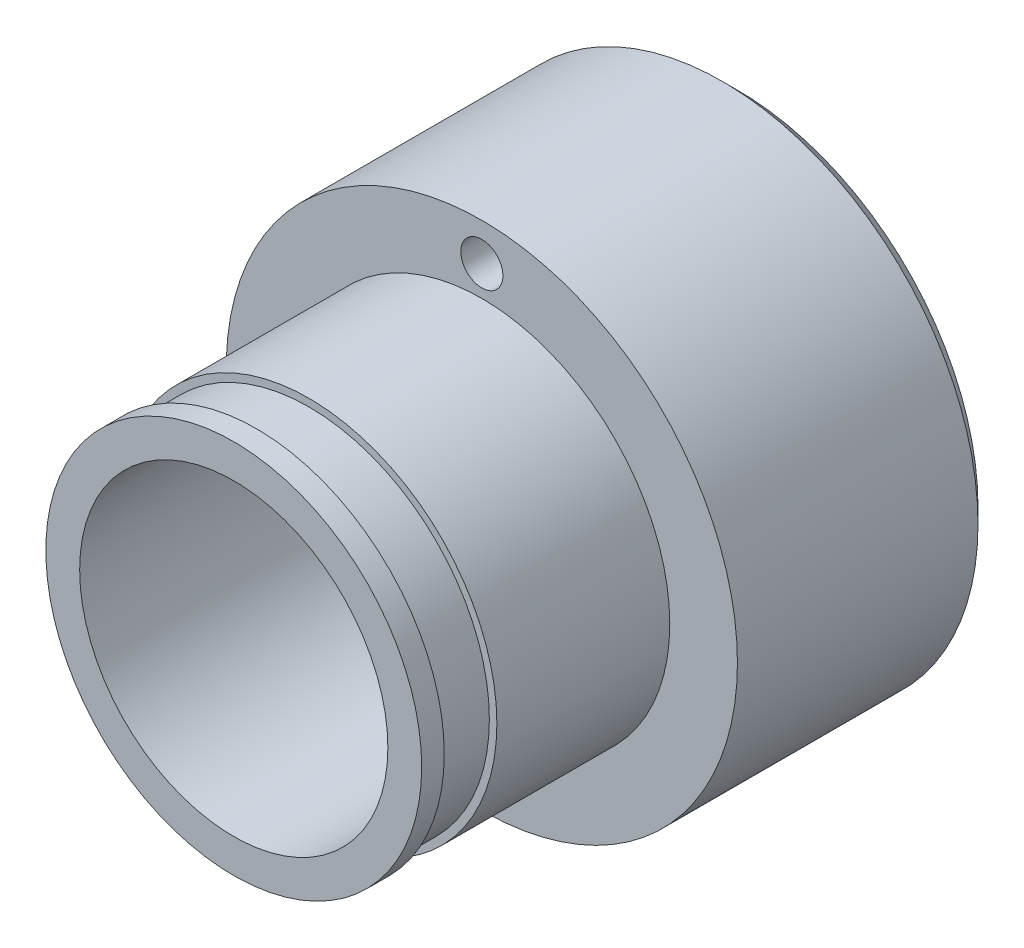
from build123d import *

# Parameters (mm, degrees)
ESQUISSE1_R                    = 17
BOSS_EXTRU_1_DEPTH             = 17
ESQUISSE2_R                    = 12.5
BOSS_EXTRU_2_DEPTH             = 11.5
ESQUISSE3_R                    = 12
BOSS_EXTRU_3_DEPTH             = 3.5
ESQUISSE4_R                    = 12.5
BOSS_EXTRU_4_DEPTH             = 1.5
ESQUISSE5_R                    = 10.25
ENL_V_MAT_EXTRU_1_DEPTH        = 30
ESQUISSE6_R                    = 10.25
ESQUISSE6_R_2                  = 6.75
ENL_V_MAT_EXTRU_2_DEPTH        = 1.5
ESQUISSE7_R                    = 12
ESQUISSE7_R_2                  = 10.25
ENL_V_MAT_EXTRU_3_DEPTH        = 2
F_2_8_2_8_DIAMETER_HOLE1_D     = 2.8
F_2_8_2_8_DIAMETER_HOLE1_DEPTH = 12
F_2_8_2_8_DIAMETER_HOLE1_TIP   = 0.841204867
CHANFREIN1_SIZE                = 1


with BuildPart() as part:
    # Esquisse1 → Boss.-Extru.1 (new body)
    with BuildSketch(Plane.XY):
        Circle(ESQUISSE1_R)
    extrude(amount=BOSS_EXTRU_1_DEPTH)

    # Esquisse2 → Boss.-Extru.2 (add)
    with BuildSketch(Plane.XY.offset(17)):
        Circle(ESQUISSE2_R)
    extrude(amount=BOSS_EXTRU_2_DEPTH)

    # Esquisse3 → Boss.-Extru.3 (add)
    with BuildSketch(Plane.XY.offset(28.5)):
        Circle(ESQUISSE3_R)
    extrude(amount=BOSS_EXTRU_3_DEPTH)

    # Esquisse4 → Boss.-Extru.4 (add)
    with BuildSketch(Plane.XY.offset(32)):
        Circle(ESQUISSE4_R)
    extrude(amount=BOSS_EXTRU_4_DEPTH)

    # Esquisse5 → Enlèv. mat.-Extru.1 (cut)
    with BuildSketch(Plane.XY.offset(33.5)):
        Circle(ESQUISSE5_R)
    extrude(amount=-ENL_V_MAT_EXTRU_1_DEPTH, mode=Mode.SUBTRACT)

    # Esquisse6 → Enlèv. mat.-Extru.2 (cut)
    with BuildSketch(Plane.XY.offset(3.5)):
        Circle(ESQUISSE6_R)
        Circle(ESQUISSE6_R_2, mode=Mode.SUBTRACT)
    extrude(amount=-ENL_V_MAT_EXTRU_2_DEPTH, mode=Mode.SUBTRACT)

    # Esquisse7 → Enlèv. mat.-Extru.3 (cut)
    with BuildSketch(Plane.XY.offset(3.5)):
        Circle(ESQUISSE7_R)
        Circle(ESQUISSE7_R_2, mode=Mode.SUBTRACT)
    extrude(amount=ENL_V_MAT_EXTRU_3_DEPTH, mode=Mode.SUBTRACT)

    # Ø2.8 (2.8) Diameter Hole1
    with Locations(Plane.XY.offset(17)):
        with Locations((0, 14.5)):
            Hole(F_2_8_2_8_DIAMETER_HOLE1_D / 2, depth=F_2_8_2_8_DIAMETER_HOLE1_DEPTH)
            with Locations((0, 0, -(F_2_8_2_8_DIAMETER_HOLE1_DEPTH + F_2_8_2_8_DIAMETER_HOLE1_TIP / 2))):  # 118° drill point
                Cone(0, F_2_8_2_8_DIAMETER_HOLE1_D / 2, F_2_8_2_8_DIAMETER_HOLE1_TIP, mode=Mode.SUBTRACT)

    # Chanfrein1
    chanfrein1_edges = [part.edges().sort_by_distance(p)[0] for p in [
        (-17, 0, 0),
    ]]
    chamfer(chanfrein1_edges, length=CHANFREIN1_SIZE)


solid = part.part
